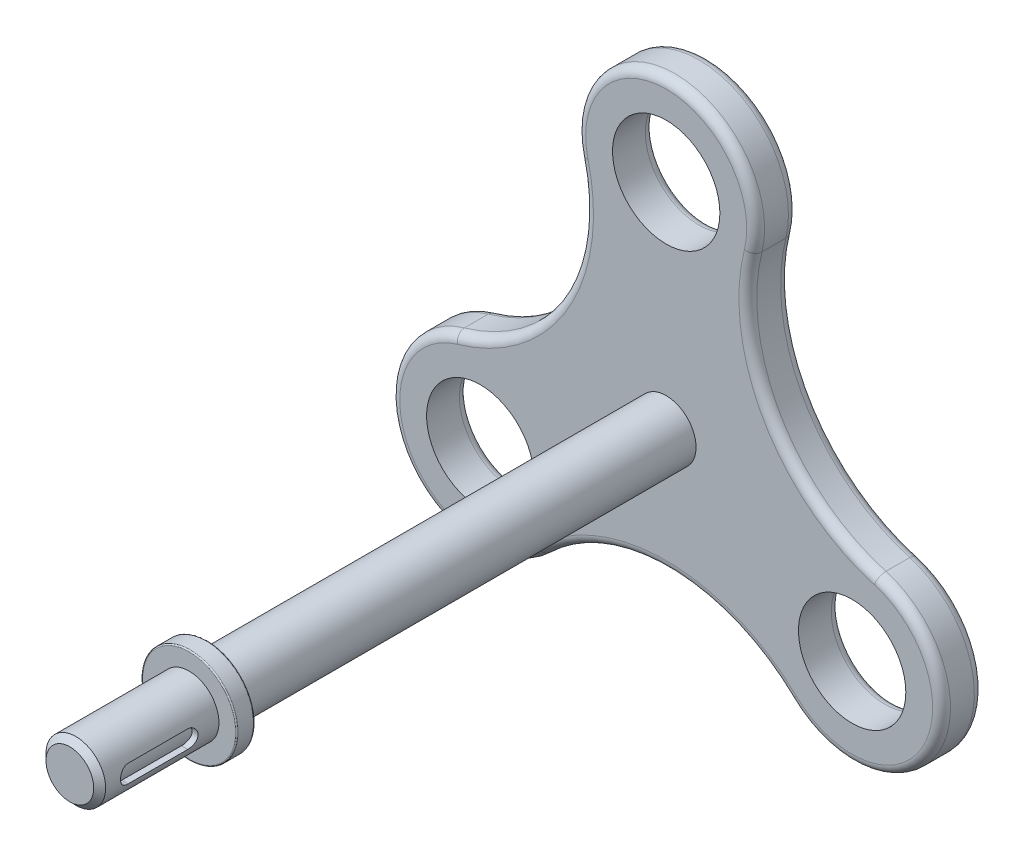
from build123d import *

# Parameters (mm, degrees)
SKETCH2_R               = 2.5
SKETCH2_R_2             = 4.5
BOSS_EXTRUDE1_DEPTH     = 1.75
SKETCH6_R               = 2.5
BOSS_EXTRUDE2_DEPTH     = 53.5
FILLET1_R               = 0.75
SKETCH7_W               = 1.5
SKETCH7_H               = 1.5
CUT_EXTRUDE1_REACH      = 69.14
CUT_EXTRUDE1_END_RADIUS = 2
CUT_EXTRUDE1_START      = 5
CHAMFER1_SIZE           = 0.5
FILLET2_R               = 0.1


with BuildPart() as part:
    # Sketch2 → Boss-Extrude1 (new, symmetric)
    with BuildSketch(Plane.XY):
        with BuildLine():
            ThreePointArc((-10.392304845, -14.408326913), (0, -10.22498074), (10.392304845, -14.408326913))
            ThreePointArc((10.392304845, -14.408326913), (22.083647797, -12.75), (17.674129556, -1.795836543))
            ThreePointArc((17.674129556, -1.795836543), (8.855093074, 5.11249037), (7.28182471, 16.204163457))
            ThreePointArc((7.28182471, 16.204163457), (0, 25.5), (-7.28182471, 16.204163457))
            ThreePointArc((-7.28182471, 16.204163457), (-8.855093074, 5.11249037), (-17.674129556, -1.795836543))
            ThreePointArc((-17.674129556, -1.795836543), (-22.083647797, -12.75), (-10.392304845, -14.408326913))
        make_face()
        Circle(SKETCH2_R, mode=Mode.SUBTRACT)
        with Locations((0, 18)):
            Circle(SKETCH2_R_2, mode=Mode.SUBTRACT)
        with Locations((-15.588457268, -9)):
            Circle(SKETCH2_R_2, mode=Mode.SUBTRACT)
        with Locations((15.588457268, -9)):
            Circle(SKETCH2_R_2, mode=Mode.SUBTRACT)
    extrude(amount=BOSS_EXTRUDE1_DEPTH, both=True)

    # Sketch6 → Boss-Extrude2 (add)
    with BuildSketch(Plane(origin=(0, 0, -1.75), x_dir=(-1, 0, 0), z_dir=(0, 0, -1))):
        Circle(SKETCH6_R)
    extrude(amount=-BOSS_EXTRUDE2_DEPTH)

    # Fillet1
    fillet1_edges = [part.edges().sort_by_distance(p)[0] for p in [
        (-22.083647797, -12.75, -1.75),
        (-8.855093074, 5.11249037, -1.75),
        (0, 25.5, -1.75),
        (8.855093074, 5.11249037, -1.75),
        (22.083647797, -12.75, -1.75),
        (0, -10.22498074, -1.75),
        (11.088457268, -9, -1.75),
        (-20.088457268, -9, -1.75),
        (-4.5, 18, -1.75),
        (0, -10.22498074, 1.75),
        (22.083647797, -12.75, 1.75),
        (8.855093074, 5.11249037, 1.75),
        (0, 25.5, 1.75),
        (-8.855093074, 5.11249037, 1.75),
        (-22.083647797, -12.75, 1.75),
    ]]
    fillet(fillet1_edges, radius=FILLET1_R)

    # Sketch7 → Revolve1 (revolve)
    with BuildSketch(Plane(origin=(0, 0, 0), x_dir=(1, 0, 0), z_dir=(0, 1, 0)), mode=Mode.PRIVATE) as revolve1_sk:
        with Locations((3.25, -41)):
            Rectangle(SKETCH7_W, SKETCH7_H)
    revolve(revolve1_sk.sketch.rotate(Axis((0, 0, 51.75), (0, 0, -1)), 180), axis=Axis((0, 0, 51.75), (0, 0, -1)))

    # Cut-Extrude1: up to this cylinder (the profile starts outside it)
    cut_extrude1_end = Plane(origin=(0, 0, 46.75), z_dir=(0, 0, -1)) * Cylinder(CUT_EXTRUDE1_END_RADIUS, 143.28, mode=Mode.PRIVATE)
    # Sketch8 → Cut-Extrude1 (cut, up to the surface)
    with BuildSketch(Plane(origin=(0, 0, 0), x_dir=(0, 0, -1), z_dir=(1, 0, 0)).offset(CUT_EXTRUDE1_START), mode=Mode.PRIVATE) as cut_extrude1_sk1:
        with BuildLine():
            Line((-49.25, 0.75), (-44.25, 0.75))
            ThreePointArc((-44.25, 0.75), (-43.5, 0), (-44.25, -0.75))
            Line((-44.25, -0.75), (-49.25, -0.75))
            ThreePointArc((-49.25, -0.75), (-50, 0), (-49.25, 0.75))
        make_face()
    cut_extrude1_tool1 = extrude(cut_extrude1_sk1.sketch, amount=-CUT_EXTRUDE1_REACH, mode=Mode.PRIVATE) - cut_extrude1_end
    add(cut_extrude1_tool1.solids().sort_by_distance((5, 0, 46.75))[0], mode=Mode.SUBTRACT)

    # Chamfer1
    chamfer1_edges = [part.edges().sort_by_distance(p)[0] for p in [
        (2.5, 0, 51.75),
    ]]
    chamfer(chamfer1_edges, length=CHAMFER1_SIZE)

    # Fillet2
    fillet2_edges = [part.edges().sort_by_distance(p)[0] for p in [
        (4, 0, 41.75),
        (4, 0, 40.25),
    ]]
    fillet(fillet2_edges, radius=FILLET2_R)


solid = part.part
